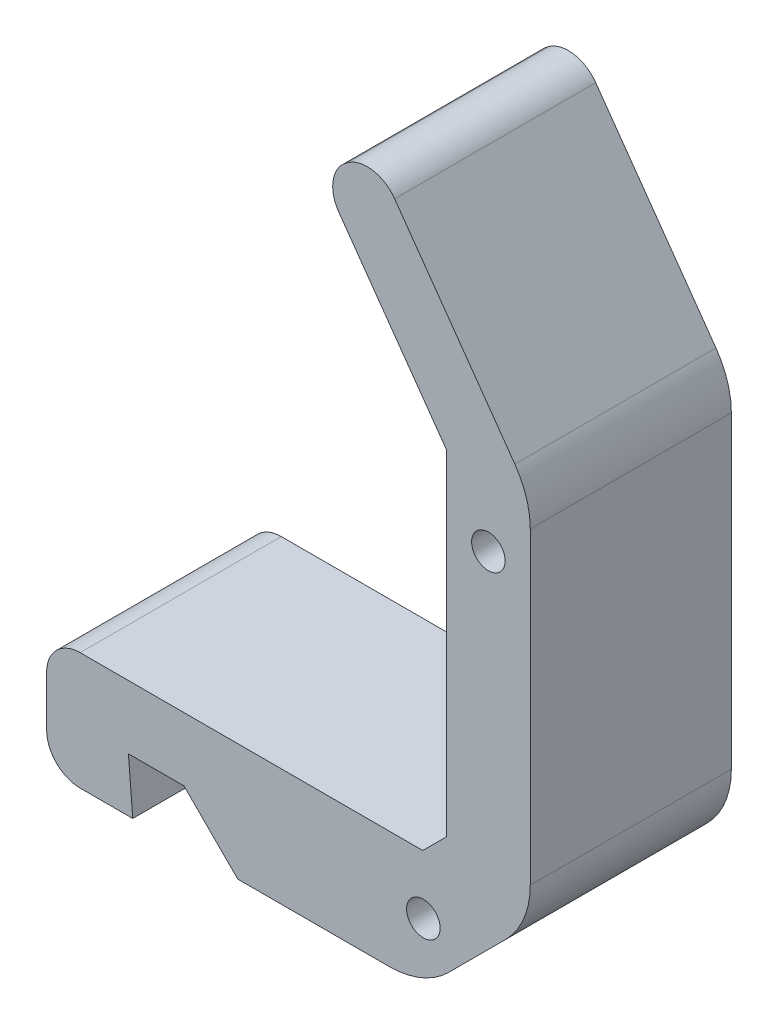
from build123d import *

# Parameters (mm, degrees)
SKETCH1_R           = 1.27
BOSS_EXTRUDE1_DEPTH = 15.24
BIG_FILL_R          = 6.35
FILLET1_R           = 2.54


with BuildPart() as part:
    # Sketch1 → Boss-Extrude1 (new body)
    with BuildSketch(Plane.XY):
        Polygon((0, 0), (-14.108343909, 0), (-18.190770029, 4.082426119), (-22.399065773, 4.082426119), (-22.068202315, 0), (-28.595630403, 0), (-28.595630403, 8.89), (-0.090256121, 8.89), (1.705795103, 10.686051224), (1.705795103, 36.086051224), (-7.919873827, 49.670016208), (-3.692519109, 52.665541963), (8.055795103, 36.086051224), (8.055795103, 8.055795103), align=None)
        with Locations(Location((-0.045128061, 4.445, 0), (0, 0, 180))):
            Circle(SKETCH1_R, mode=Mode.SUBTRACT)
        with Locations(Location((4.880795103, 31.006051224, 0), (0, 0, 180))):
            Circle(SKETCH1_R, mode=Mode.SUBTRACT)
    extrude(amount=BOSS_EXTRUDE1_DEPTH)

    # big_fill
    big_fill_edges = [part.edges().sort_by_distance(p)[0] for p in [
        (0, 0, 7.62),
        (8.055795103, 36.086051224, 7.62),
        (8.055795103, 8.055795103, 7.62),
    ]]
    fillet(big_fill_edges, radius=BIG_FILL_R)

    # Fillet1
    fillet1_edges = [part.edges().sort_by_distance(p)[0] for p in [
        (-28.595630403, 0, 7.62),
        (-28.595630403, 8.89, 7.62),
        (-7.919873827, 49.670016208, 7.62),
        (-3.692519109, 52.665541963, 7.62),
    ]]
    fillet(fillet1_edges, radius=FILLET1_R)


solid = part.part
